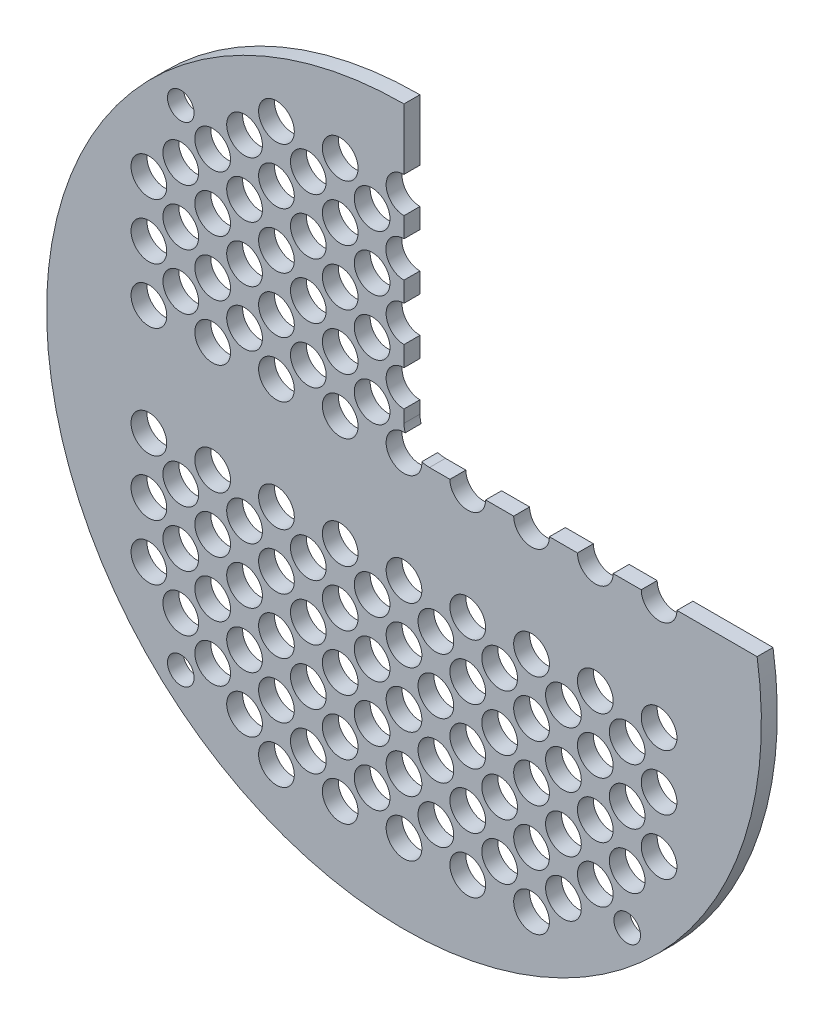
from build123d import *

# Parameters (mm, degrees)
SKETCH1_R               = 213.51875
BOSS_EXTRUDE1_DEPTH     = 9.525
CUT_EXTRUDE4_DEPTH      = 303.111302053
CUT_EXTRUDE4_DEPTH_BACK = 303.111302053
SKETCH11_R              = 10.668
SKETCH11_R_2            = 7.9375


with BuildPart() as part:
    # Sketch1 → Boss-Extrude1 (new body)
    with BuildSketch(Plane.XY):
        Circle(SKETCH1_R)
    extrude(amount=BOSS_EXTRUDE1_DEPTH)

    # Sketch11 → Cut-Extrude4 (cut, two sides: drawn at the far end of the back side and taken through both)
    with BuildSketch(Plane.XY.offset(-CUT_EXTRUDE4_DEPTH_BACK)):
        with Locations((-38.1, 33.02)):
            Circle(SKETCH11_R)
        with Locations((-76.2, 33.02)):
            Circle(SKETCH11_R)
        with Locations((-114.3, 33.02)):
            Circle(SKETCH11_R)
        with Locations((-152.4, 33.02)):
            Circle(SKETCH11_R)
        with Locations((-38.1, 66.3575)):
            Circle(SKETCH11_R)
        with Locations((-76.2, 66.3575)):
            Circle(SKETCH11_R)
        with Locations((-114.3, 66.3575)):
            Circle(SKETCH11_R)
        with Locations((-152.4, 66.3575)):
            Circle(SKETCH11_R)
        with Locations((-38.1, 99.695)):
            Circle(SKETCH11_R)
        with Locations((-76.2, 99.695)):
            Circle(SKETCH11_R)
        with Locations((-114.3, 99.695)):
            Circle(SKETCH11_R)
        with Locations((-133.35, 146.05)):
            Circle(SKETCH11_R_2)
        with Locations((-152.4, 99.695)):
            Circle(SKETCH11_R)
        with Locations((-38.1, 133.0325)):
            Circle(SKETCH11_R)
        with Locations((-76.2, 133.0325)):
            Circle(SKETCH11_R)
        with Locations((-114.3, 133.0325)):
            Circle(SKETCH11_R)
        with Locations((-38.1, 166.37)):
            Circle(SKETCH11_R)
        with Locations((-76.2, 166.37)):
            Circle(SKETCH11_R)
        with Locations((-19.05, 49.8475)):
            Circle(SKETCH11_R)
        with Locations((-57.15, 49.8475)):
            Circle(SKETCH11_R)
        with Locations((-95.25, 49.8475)):
            Circle(SKETCH11_R)
        with Locations((-133.35, 49.8475)):
            Circle(SKETCH11_R)
        with Locations((-19.05, 83.185)):
            Circle(SKETCH11_R)
        with Locations((-57.15, 83.185)):
            Circle(SKETCH11_R)
        with Locations((-95.25, 83.185)):
            Circle(SKETCH11_R)
        with Locations((-133.35, 83.185)):
            Circle(SKETCH11_R)
        with Locations((-19.05, 116.5225)):
            Circle(SKETCH11_R)
        with Locations((-57.15, 116.5225)):
            Circle(SKETCH11_R)
        with Locations((-95.25, 116.5225)):
            Circle(SKETCH11_R)
        with Locations((-133.35, 116.5225)):
            Circle(SKETCH11_R)
        with Locations((-19.05, 149.86)):
            Circle(SKETCH11_R)
        with Locations((-57.15, 149.86)):
            Circle(SKETCH11_R)
        with Locations((-95.25, 149.86)):
            Circle(SKETCH11_R)
        with Locations((-133.35, -146.05)):
            Circle(SKETCH11_R_2)
        with Locations((133.35, -146.05)):
            Circle(SKETCH11_R_2)
        with Locations((114.3, -133.0325)):
            Circle(SKETCH11_R)
        with Locations((152.4, -33.02)):
            Circle(SKETCH11_R)
        with Locations((95.25, -149.86)):
            Circle(SKETCH11_R)
        with Locations((57.15, -149.86)):
            Circle(SKETCH11_R)
        with Locations((-95.25, -149.86)):
            Circle(SKETCH11_R)
        with Locations((-57.15, -149.86)):
            Circle(SKETCH11_R)
        with Locations((-19.05, -149.86)):
            Circle(SKETCH11_R)
        with Locations((19.05, -149.86)):
            Circle(SKETCH11_R)
        with Locations((133.35, -116.5225)):
            Circle(SKETCH11_R)
        with Locations((95.25, -116.5225)):
            Circle(SKETCH11_R)
        with Locations((57.15, -116.5225)):
            Circle(SKETCH11_R)
        with Locations((19.05, -116.5225)):
            Circle(SKETCH11_R)
        with Locations((133.35, -83.185)):
            Circle(SKETCH11_R)
        with Locations((95.25, -83.185)):
            Circle(SKETCH11_R)
        with Locations((57.15, -83.185)):
            Circle(SKETCH11_R)
        with Locations((19.05, -83.185)):
            Circle(SKETCH11_R)
        with Locations((133.35, -49.8475)):
            Circle(SKETCH11_R)
        with Locations((95.25, -49.8475)):
            Circle(SKETCH11_R)
        with Locations((57.15, -49.8475)):
            Circle(SKETCH11_R)
        with Locations((19.05, -49.8475)):
            Circle(SKETCH11_R)
        with Locations((-76.2, -166.37)):
            Circle(SKETCH11_R)
        with Locations((-38.1, -166.37)):
            Circle(SKETCH11_R)
        with Locations((76.2, -166.37)):
            Circle(SKETCH11_R)
        with Locations((38.1, -166.37)):
            Circle(SKETCH11_R)
        with Locations((0, -166.37)):
            Circle(SKETCH11_R)
        with Locations((76.2, -133.0325)):
            Circle(SKETCH11_R)
        with Locations((38.1, -133.0325)):
            Circle(SKETCH11_R)
        with Locations((152.4, -99.695)):
            Circle(SKETCH11_R)
        with Locations((114.3, -99.695)):
            Circle(SKETCH11_R)
        with Locations((76.2, -99.695)):
            Circle(SKETCH11_R)
        with Locations((38.1, -99.695)):
            Circle(SKETCH11_R)
        with Locations((152.4, -66.3575)):
            Circle(SKETCH11_R)
        with Locations((114.3, -66.3575)):
            Circle(SKETCH11_R)
        with Locations((76.2, -66.3575)):
            Circle(SKETCH11_R)
        with Locations((38.1, -66.3575)):
            Circle(SKETCH11_R)
        with Locations((114.3, -33.02)):
            Circle(SKETCH11_R)
        with Locations((76.2, -33.02)):
            Circle(SKETCH11_R)
        with Locations((38.1, -33.02)):
            Circle(SKETCH11_R)
        with Locations((0, -133.0325)):
            Circle(SKETCH11_R)
        with Locations((0, -99.695)):
            Circle(SKETCH11_R)
        with Locations((0, -66.3575)):
            Circle(SKETCH11_R)
        with Locations((0, -33.02)):
            Circle(SKETCH11_R)
        with Locations((-38.1, -33.02)):
            Circle(SKETCH11_R)
        with Locations((-76.2, -33.02)):
            Circle(SKETCH11_R)
        with Locations((-114.3, -33.02)):
            Circle(SKETCH11_R)
        with Locations((-38.1, -66.3575)):
            Circle(SKETCH11_R)
        with Locations((-76.2, -66.3575)):
            Circle(SKETCH11_R)
        with Locations((-114.3, -66.3575)):
            Circle(SKETCH11_R)
        with Locations((-152.4, -66.3575)):
            Circle(SKETCH11_R)
        with Locations((-38.1, -99.695)):
            Circle(SKETCH11_R)
        with Locations((-76.2, -99.695)):
            Circle(SKETCH11_R)
        with Locations((-114.3, -99.695)):
            Circle(SKETCH11_R)
        with Locations((-152.4, -99.695)):
            Circle(SKETCH11_R)
        with Locations((-38.1, -133.0325)):
            Circle(SKETCH11_R)
        with Locations((-76.2, -133.0325)):
            Circle(SKETCH11_R)
        with Locations((-19.05, -49.8475)):
            Circle(SKETCH11_R)
        with Locations((-57.15, -49.8475)):
            Circle(SKETCH11_R)
        with Locations((-95.25, -49.8475)):
            Circle(SKETCH11_R)
        with Locations((-133.35, -49.8475)):
            Circle(SKETCH11_R)
        with Locations((-19.05, -83.185)):
            Circle(SKETCH11_R)
        with Locations((-57.15, -83.185)):
            Circle(SKETCH11_R)
        with Locations((-95.25, -83.185)):
            Circle(SKETCH11_R)
        with Locations((-133.35, -83.185)):
            Circle(SKETCH11_R)
        with Locations((-19.05, -116.5225)):
            Circle(SKETCH11_R)
        with Locations((-57.15, -116.5225)):
            Circle(SKETCH11_R)
        with Locations((-95.25, -116.5225)):
            Circle(SKETCH11_R)
        with Locations((-133.35, -116.5225)):
            Circle(SKETCH11_R)
        with Locations((-152.4, -33.02)):
            Circle(SKETCH11_R)
        with Locations((-114.3, -133.0325)):
            Circle(SKETCH11_R)
        with BuildLine():
            Line((15.24, 33.02), (27.432, 33.02))
            ThreePointArc((27.432, 33.02), (38.1, 22.352), (48.768, 33.02))
            Line((48.768, 33.02), (65.532, 33.02))
            ThreePointArc((65.532, 33.02), (76.2, 22.352), (86.868, 33.02))
            Line((86.868, 33.02), (103.632, 33.02))
            ThreePointArc((103.632, 33.02), (114.3, 22.352), (124.968, 33.02))
            Line((124.968, 33.02), (141.732, 33.02))
            ThreePointArc((141.732, 33.02), (152.4, 22.352), (163.068, 33.02))
            Line((163.068, 33.02), (216.209944202, 33.02))
            Line((216.209944202, 33.02), (216.209944202, 230.055131375))
            Line((216.209944202, 230.055131375), (0, 230.055131375))
            Line((0, 230.055131375), (0, 177.038))
            ThreePointArc((0, 177.038), (-10.668, 166.37), (0, 155.702))
            Line((0, 155.702), (0, 143.7005))
            ThreePointArc((0, 143.7005), (-10.846696778, 133.026787869), (0, 122.353075737))
            Line((0, 122.353075737), (0, 110.363))
            ThreePointArc((0, 110.363), (-10.668, 99.695), (0, 89.027))
            Line((0, 89.027), (0, 77.0255))
            ThreePointArc((0, 77.0255), (-10.668, 66.3575), (0, 55.6895))
            Line((0, 55.6895), (0, 48.26))
            ThreePointArc((0, 48.26), (0.17839762, 45.934976616), (0.709413876, 43.664386124))
            ThreePointArc((0.709413876, 43.664386124), (-7.543415142, 25.476584858), (10.644386124, 33.729413876))
            ThreePointArc((10.644386124, 33.729413876), (12.914976616, 33.19839762), (15.24, 33.02))
        make_face()
    extrude(amount=CUT_EXTRUDE4_DEPTH + CUT_EXTRUDE4_DEPTH_BACK, mode=Mode.SUBTRACT)


solid = part.part
